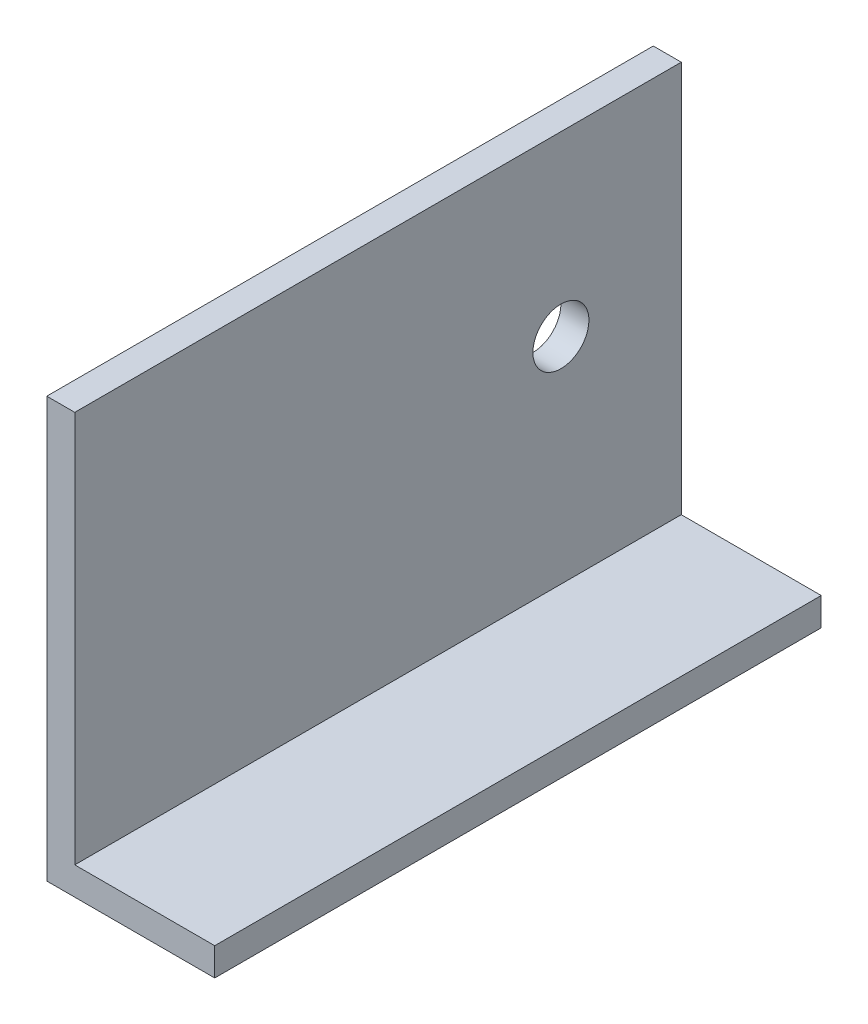
from build123d import *

# Parameters (mm, degrees)
SKETCH_1_W          = 15
SKETCH_1_H          = 3
EXTRUDE_1_DEPTH     = 65
SKETCH_2_R          = 3
CUT_EXTRUDE_1_DEPTH = 64.5


with BuildPart() as part:
    # 草图1 → 凸台-拉伸1 (new body)
    with BuildSketch(Plane.XY):
        Polygon((3, 45), (0, 45), (0, 0), (3, 0), (3, 3), align=None)
        with Locations((10.5, 1.5)):
            Rectangle(SKETCH_1_W, SKETCH_1_H)
    extrude(amount=EXTRUDE_1_DEPTH)

    # 草图2 → 切除-拉伸1 (cut)
    with BuildSketch(Plane(origin=(3, 0, 0), x_dir=(0, 0, -1), z_dir=(1, 0, 0))):
        with Locations(Location((-12.9, 26, 0), (0, 0, 90))):
            Circle(SKETCH_2_R)
    extrude(amount=-CUT_EXTRUDE_1_DEPTH, mode=Mode.SUBTRACT)


solid = part.part
